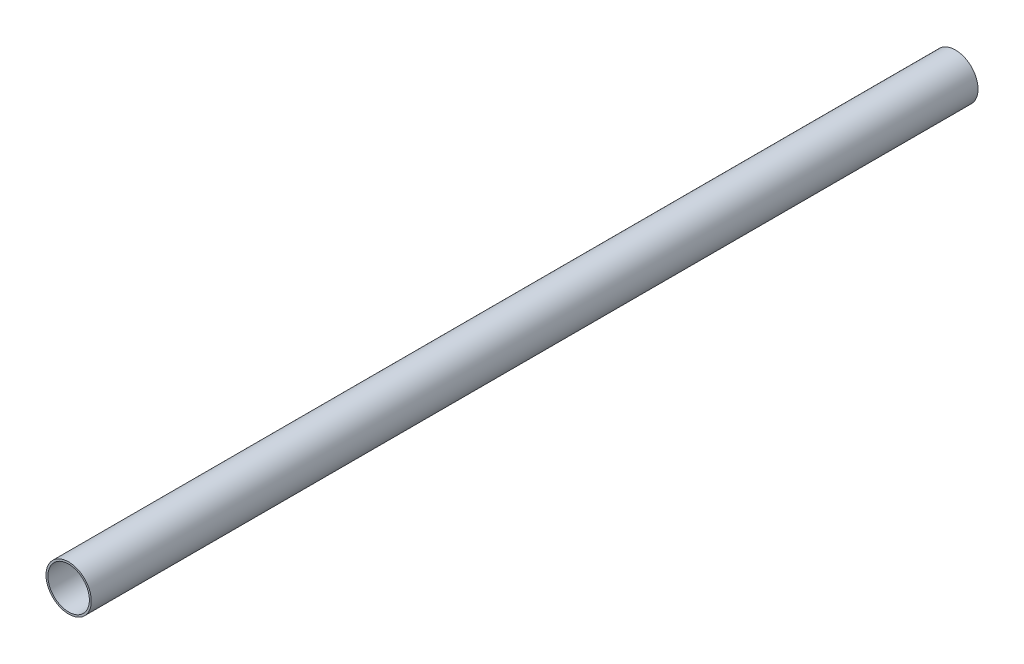
from build123d import *

# Parameters (mm, degrees)
IZIM1_R                     = 12
IZIM1_R_2                   = 11
Y_KSEKLIK_EKSTR_ZYON1_DEPTH = 470


with BuildPart() as part:
    # Çizim1 → Yükseklik-Ekstrüzyon1 (new body)
    with BuildSketch(Plane.XY):
        with Locations(Location((0, 0, 0), (0, 0, 180))):
            Circle(IZIM1_R)
        with Locations(Location((0, 0, 0), (0, 0, 180))):
            Circle(IZIM1_R_2, mode=Mode.SUBTRACT)
    extrude(amount=Y_KSEKLIK_EKSTR_ZYON1_DEPTH)


solid = part.part
